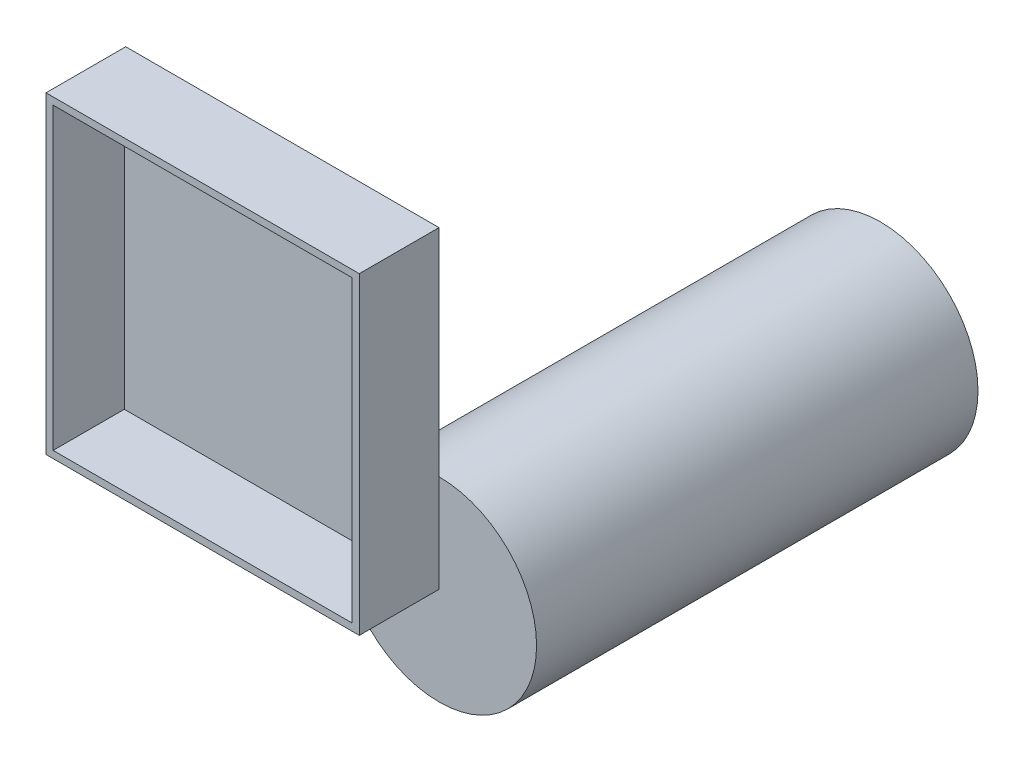
from build123d import *

# Parameters (mm, degrees)
SKETCH_1_R      = 34.25
SKETCH_1_R_2    = 31.75
EXTRUDE_1_DEPTH = 150
SKETCH_3_R      = 34.25
EXTRUDE_2_DEPTH = 5
SKETCH_4_W      = 110
SKETCH_4_H      = 110
EXTRUDE_3_DEPTH = 3
SKETCH_5_W      = 110
SKETCH_5_H      = 110
SKETCH_5_W_2    = 105
SKETCH_5_H_2    = 105
EXTRUDE_4_DEPTH = 25


with BuildPart() as part:
    # 草圖1 → 填料-伸長1 (new body)
    with BuildSketch(Plane.XY):
        Circle(SKETCH_1_R)
        Circle(SKETCH_1_R_2, mode=Mode.SUBTRACT)
    extrude(amount=EXTRUDE_1_DEPTH)

    # 草圖3 → 填料-伸長2 (add)
    with BuildSketch(Plane.XY.offset(150)):
        Circle(SKETCH_3_R)
    extrude(amount=EXTRUDE_2_DEPTH)

    # 草圖4 → 填料-伸長3 (add)
    with BuildSketch(Plane.XY.offset(155)):
        with Locations((-55, 55)):
            Rectangle(SKETCH_4_W, SKETCH_4_H)
    extrude(amount=EXTRUDE_3_DEPTH)

    # 草圖5 → 填料-伸長4 (add)
    with BuildSketch(Plane.XY.offset(158)):
        with Locations((-55, 55)):
            Rectangle(SKETCH_5_W, SKETCH_5_H)
        with Locations((-55, 55)):
            Rectangle(SKETCH_5_W_2, SKETCH_5_H_2, mode=Mode.SUBTRACT)
    extrude(amount=EXTRUDE_4_DEPTH)


solid = part.part
